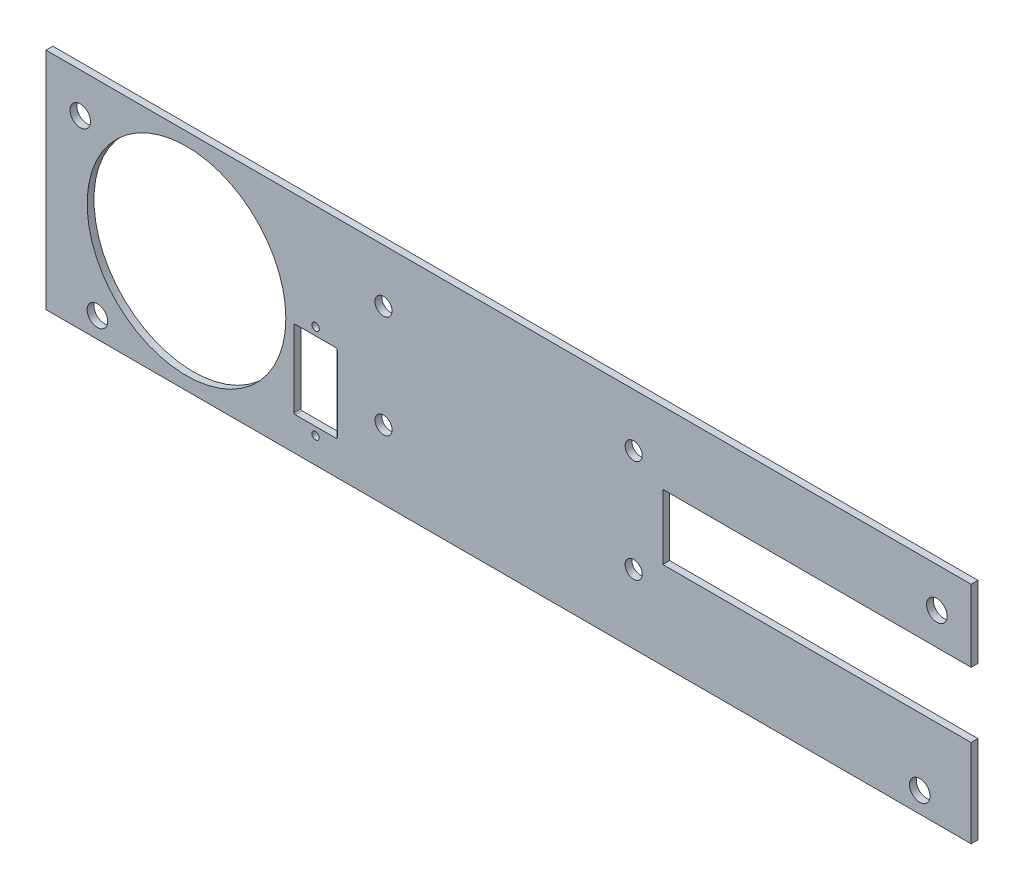
from build123d import *

# Parameters (mm, degrees)
SKETCH1_W           = 270
SKETCH1_H           = 60
BOSS_EXTRUDE1_DEPTH = 2
SKETCH6_W           = 270
SKETCH6_H           = 5.6
BOSS_EXTRUDE2_DEPTH = 2
SKETCH7_R           = 2.5
SKETCH7_R_2         = 3
CUT_EXTRUDE1_DEPTH  = 140.629366539
SKETCH8_W           = 90
SKETCH8_H           = 10
CUT_EXTRUDE2_DEPTH  = 140.629366539
SKETCH9_R           = 29
CUT_EXTRUDE3_DEPTH  = 10
SKETCH10_R          = 1.0668
CUT_EXTRUDE4_DEPTH  = 10
SKETCH11_W          = 90
SKETCH11_H          = 9
CUT_EXTRUDE5_DEPTH  = 10


with BuildPart() as part:
    # Sketch1 → Boss-Extrude1 (new body)
    with BuildSketch(Plane.XY):
        Rectangle(SKETCH1_W, SKETCH1_H)
    extrude(amount=BOSS_EXTRUDE1_DEPTH)

    # Sketch6 → Boss-Extrude2 (add)
    with BuildSketch(Plane.XY.offset(2)):
        with Locations((0, 32.8)):
            Rectangle(SKETCH6_W, SKETCH6_H)
    extrude(amount=-BOSS_EXTRUDE2_DEPTH)

    # Sketch7 → Cut-Extrude1 (cut, through all)
    with BuildSketch(Plane(origin=(0, 0, 0), x_dir=(-1, 0, 0), z_dir=(0, 0, -1))):
        with Locations((-36.5, 20.124709067)):
            Circle(SKETCH7_R)
        with Locations((-36.5, -9.875290933)):
            Circle(SKETCH7_R)
        with Locations((36.5, -9.875290933)):
            Circle(SKETCH7_R)
        with Locations((36.5, 20.124709067)):
            Circle(SKETCH7_R)
        with Locations((125, 24)):
            Circle(SKETCH7_R_2)
        with Locations((120, -24)):
            Circle(SKETCH7_R_2)
        with Locations((-125, 24)):
            Circle(SKETCH7_R_2)
        with Locations((-120, -24)):
            Circle(SKETCH7_R_2)
    extrude(amount=-CUT_EXTRUDE1_DEPTH, mode=Mode.SUBTRACT)

    # Sketch8 → Cut-Extrude2 (cut, through all)
    with BuildSketch(Plane(origin=(0, 0, 0), x_dir=(-1, 0, 0), z_dir=(0, 0, -1))):
        with Locations((-90, 9.6)):
            Rectangle(SKETCH8_W, SKETCH8_H)
    extrude(amount=-CUT_EXTRUDE2_DEPTH, mode=Mode.SUBTRACT)

    # Sketch9 → Cut-Extrude3 (cut)
    with BuildSketch(Plane.XY.offset(2)):
        with Locations((-94, 2.8)):
            Circle(SKETCH9_R)
    extrude(amount=-CUT_EXTRUDE3_DEPTH, mode=Mode.SUBTRACT)

    # Sketch10 → Cut-Extrude4 (cut)
    with BuildSketch(Plane(origin=(0, 0, 0), x_dir=(-1, 0, 0), z_dir=(0, 0, -1))):
        with Locations((56.3119, -22.5108)):
            Circle(SKETCH10_R)
        with Locations((56.3119, 5.0228)):
            Circle(SKETCH10_R)
        with BuildLine():
            Line((62.6238, -19.793), (62.6238, 2.305))
            ThreePointArc((62.6238, 2.305), (62.512207684, 2.574407684), (62.2428, 2.686))
            Line((62.2428, 2.686), (50.381, 2.686))
            ThreePointArc((50.381, 2.686), (50.111592316, 2.574407684), (50, 2.305))
            Line((50, 2.305), (50, -19.793))
            ThreePointArc((50, -19.793), (50.111592316, -20.062407684), (50.381, -20.174))
            Line((50.381, -20.174), (62.2428, -20.174))
            ThreePointArc((62.2428, -20.174), (62.512207684, -20.062407684), (62.6238, -19.793))
        make_face()
    extrude(amount=-CUT_EXTRUDE4_DEPTH, mode=Mode.SUBTRACT)

    # Sketch11 → Cut-Extrude5 (cut)
    with BuildSketch(Plane.XY.offset(2)):
        with Locations((90, 0.1)):
            Rectangle(SKETCH11_W, SKETCH11_H)
    extrude(amount=-CUT_EXTRUDE5_DEPTH, mode=Mode.SUBTRACT)


solid = part.part
